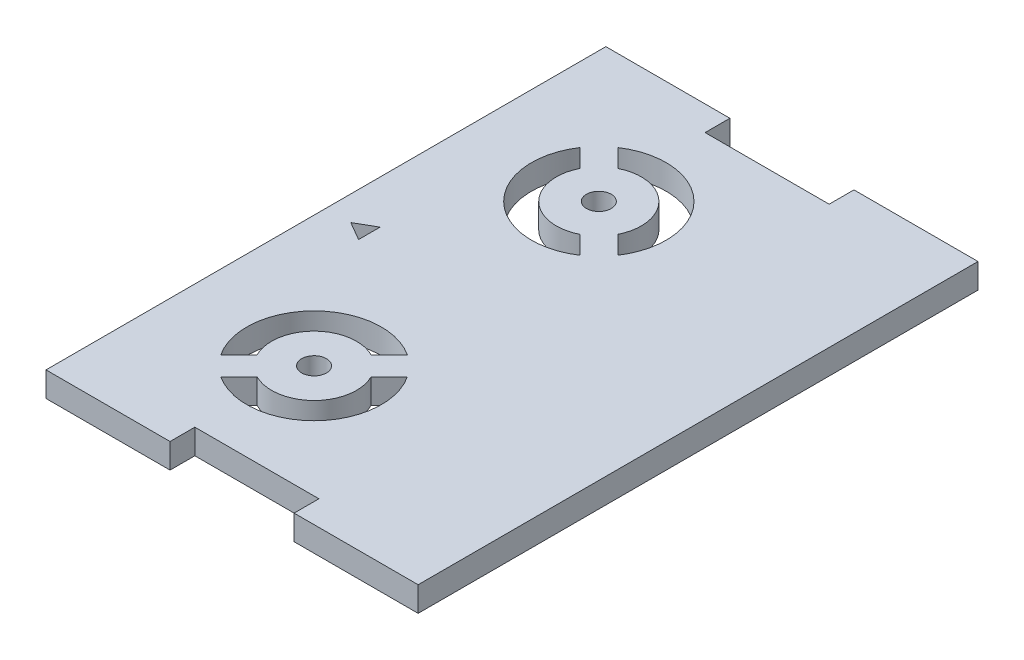
from build123d import *

# Parameters (mm, degrees)
SKETCH1_W               = 45
SKETCH1_H               = 67.7
BOSS_EXTRUDE1_DEPTH     = 1.5
CUT_EXTRUDE1_DEPTH      = 41.67336352
CUT_EXTRUDE1_DEPTH_BACK = 41.67336352
SKETCH2_W               = 15
SKETCH2_H               = 3
CUT_EXTRUDE2_DEPTH      = 41.67336352
CUT_EXTRUDE2_DEPTH_BACK = 41.67336352
SKETCH3_R               = 1.5
CUT_EXTRUDE3_DEPTH      = 41.67336352
CUT_EXTRUDE3_DEPTH_BACK = 41.67336352


with BuildPart() as part:
    # Sketch1 → Boss-Extrude1 (new, symmetric)
    with BuildSketch(Plane(origin=(0, 0, 0), x_dir=(1, 0, 0), z_dir=(0, 1, 0))):
        Rectangle(SKETCH1_W, SKETCH1_H)
    extrude(amount=BOSS_EXTRUDE1_DEPTH, both=True)

    # Sketch2 → Cut-Extrude1 (cut, two sides: drawn at the far end of the back side and taken through both)
    with BuildSketch(Plane(origin=(0, 0, 0), x_dir=(1, 0, 0), z_dir=(0, 1, 0)).offset(-CUT_EXTRUDE1_DEPTH_BACK)):
        with Locations((0, -32.35)):
            Rectangle(SKETCH2_W, SKETCH2_H)
        with Locations((0, 32.35)):
            Rectangle(SKETCH2_W, SKETCH2_H)
    extrude(amount=CUT_EXTRUDE1_DEPTH + CUT_EXTRUDE1_DEPTH_BACK, mode=Mode.SUBTRACT)

    # Sketch3 → Cut-Extrude2 (cut, two sides: drawn at the far end of the back side and taken through both)
    with BuildSketch(Plane(origin=(0, 0, 0), x_dir=(1, 0, 0), z_dir=(0, 1, 0)).offset(-CUT_EXTRUDE2_DEPTH_BACK)):
        with Locations(Location((-6.717514421, -17.217514421, 0), (0, 0, 270))):
            Circle(SKETCH3_R)
        with Locations(Location((-6.717514421, 17.217514421, 0), (0, 0, 90))):
            Circle(SKETCH3_R)
        with BuildLine():
            Line((0.072542026, 12.729181386), (-2.119583462, 14.921306874))
            ThreePointArc((-2.119583462, 14.921306874), (-3.083402548, 20.851626294), (-9.013721969, 21.815445381))
            Line((-9.013721969, 21.815445381), (-11.205847457, 24.007570869))
            ThreePointArc((-11.205847457, 24.007570869), (-0.962082205, 22.972946638), (0.072542026, 12.729181386))
        make_face()
        with BuildLine():
            Line((-2.229181386, 10.427457974), (-4.421306874, 12.619583462))
            ThreePointArc((-4.421306874, 12.619583462), (-10.351626294, 13.583402548), (-11.315445381, 19.513721969))
            Line((-11.315445381, 19.513721969), (-13.507570869, 21.705847457))
            ThreePointArc((-13.507570869, 21.705847457), (-12.472946638, 11.462082205), (-2.229181386, 10.427457974))
        make_face()
        with BuildLine():
            Line((0.072542026, -12.729181386), (-2.119583462, -14.921306874))
            ThreePointArc((-2.119583462, -14.921306874), (-3.083402548, -20.851626294), (-9.013721969, -21.815445381))
            Line((-9.013721969, -21.815445381), (-11.205847457, -24.007570869))
            ThreePointArc((-11.205847457, -24.007570869), (-0.962082205, -22.972946638), (0.072542026, -12.729181386))
        make_face()
        with BuildLine():
            Line((-2.229181386, -10.427457974), (-4.421306874, -12.619583462))
            ThreePointArc((-4.421306874, -12.619583462), (-10.351626294, -13.583402548), (-11.315445381, -19.513721969))
            Line((-11.315445381, -19.513721969), (-13.507570869, -21.705847457))
            ThreePointArc((-13.507570869, -21.705847457), (-12.472946638, -11.462082205), (-2.229181386, -10.427457974))
        make_face()
    extrude(amount=CUT_EXTRUDE2_DEPTH + CUT_EXTRUDE2_DEPTH_BACK, mode=Mode.SUBTRACT)

    # Sketch4 → Cut-Extrude3 (cut, two sides: drawn at the far end of the back side and taken through both)
    with BuildSketch(Plane(origin=(0, 0, 0), x_dir=(1, 0, 0), z_dir=(0, 1, 0)).offset(-CUT_EXTRUDE3_DEPTH_BACK)):
        Polygon((-19.5, 0), (-17.25, -1.299038106), (-17.25, 1.299038106), align=None)
    extrude(amount=CUT_EXTRUDE3_DEPTH + CUT_EXTRUDE3_DEPTH_BACK, mode=Mode.SUBTRACT)


solid = part.part
